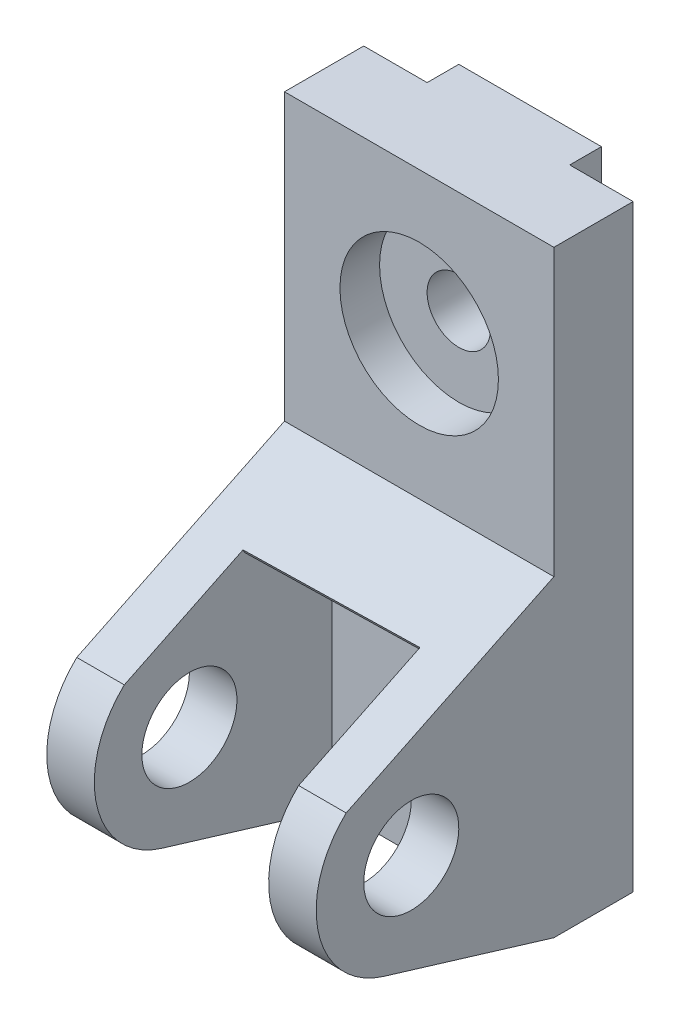
from build123d import *

# Parameters (mm, degrees)
SKETCH1_W            = 85
SKETCH1_H            = 90
SKETCH1_R            = 25
BOSS_EXTRUDE1_DEPTH  = 25
SKETCH1_3_R          = 25
BOSS_EXTRUDE2_DEPTH  = 25
SKETCH1_5_R          = 10
CUT_EXTRUDE1_DEPTH   = 72.960881466
SKETCH1_6_R          = 25
SKETCH1_6_R_2        = 10
CUT_EXTRUDE2_DEPTH   = 12.5
SKETCH3_R            = 15
BOSS_EXTRUDE3_DEPTH  = 15
SKETCH5_W            = 25
SKETCH5_H            = 98.657332742
CUT_EXTRUDE3_DEPTH   = 15
SKETCH8_W            = 85
SKETCH8_H            = 25
BOSS_EXTRUDE8_DEPTH  = 98
BOSS_EXTRUDE9_DEPTH  = 1
SKETCH12_W           = 45
SKETCH12_H           = 10
BOSS_EXTRUDE11_DEPTH = 188


with BuildPart() as part:
    # Sketch1 → Boss-Extrude1 (new body)
    with BuildSketch(Plane.XY):
        with Locations((-7.652354571, -0.145429363)):
            Rectangle(SKETCH1_W, SKETCH1_H)
        with Locations((-7.652354571, 0)):
            Circle(SKETCH1_R, mode=Mode.SUBTRACT)
    extrude(amount=-BOSS_EXTRUDE1_DEPTH)

    # Sketch3 → Boss-Extrude3 (add)
    with BuildSketch(Plane(origin=(34.847645429, 0, 0), x_dir=(0, 0, -1), z_dir=(1, 0, 0))):
        with BuildLine():
            Line((-53.708286934, -127.511049039), (0, -143.802762105))
            Line((0, -143.802762105), (25, -143.802762105))
            Line((25, -143.802762105), (25, -45.145429363))
            Line((25, -45.145429363), (0, -45.145429363))
            Line((0, -45.145429363), (-65.54026385, -76.937319943))
            ThreePointArc((-65.54026385, -76.937319943), (-74.211212735, -105.636871453), (-53.708286934, -127.511049039))
        make_face()
        with Locations((-45, -98.802762105)):
            Circle(SKETCH3_R, mode=Mode.SUBTRACT)
    extrude(amount=-BOSS_EXTRUDE3_DEPTH)


with BuildPart() as body_2:
    # Sketch1<3> → Boss-Extrude2 (new body)
    with BuildSketch(Plane.XY):
        with Locations((-7.652354571, 0)):
            Circle(SKETCH1_3_R)
    extrude(amount=-BOSS_EXTRUDE2_DEPTH)

    # Sketch1<5> → Cut-Extrude1 (cut, through all)
    with BuildSketch(Plane.XY):
        with Locations((-7.652354571, 0)):
            Circle(SKETCH1_5_R)
    extrude(amount=-CUT_EXTRUDE1_DEPTH, mode=Mode.SUBTRACT)

    # Sketch1<6> → Cut-Extrude2 (cut)
    with BuildSketch(Plane.XY):
        with Locations((-7.652354571, 0)):
            Circle(SKETCH1_6_R)
        with Locations((-7.652354571, 0)):
            Circle(SKETCH1_6_R_2, mode=Mode.SUBTRACT)
    extrude(amount=-CUT_EXTRUDE2_DEPTH, mode=Mode.SUBTRACT)


with BuildPart() as body_3:
    # Mirror1: mirrored copy
    add(part.part.mirror(Plane(origin=(-7.652354571, 0, 0), x_dir=(0, 0, 1), z_dir=(1, 0, 0))))

    # Sketch5 → Cut-Extrude3 (cut)
    with BuildSketch(Plane.ZY.offset(50.152354571)):
        with Locations((-12.5, -94.474095734)):
            Rectangle(SKETCH5_W, SKETCH5_H)
    extrude(amount=-CUT_EXTRUDE3_DEPTH, mode=Mode.SUBTRACT)


with BuildPart() as cut_extrude3_piece_1:
    # of the separate pieces the step leaves, piece 1, a body of its own (cut_extrude3_pieces)
    add(body_3.part.solids().sort_by_distance((34.847645429, 44.854570637, 0))[0])


with BuildPart() as cut_extrude3_piece_2:
    # of the separate pieces the step leaves, piece 2, a body of its own (cut_extrude3_pieces)
    add(body_3.part.solids().sort_by_distance((-50.152354571, -76.937319943, 65.54026385))[0])


with BuildPart() as part_1:
    add(part.part)

    add(cut_extrude3_piece_1.part)  # Boss-Extrude8 merges Cut-Extrude3 piece 1

    add(cut_extrude3_piece_2.part)  # Boss-Extrude8 merges Cut-Extrude3 piece 2
    # Sketch8 → Boss-Extrude8 (add)
    with BuildSketch(Plane.XZ.offset(45.145429363)):
        with Locations((-7.652354571, -12.5)):
            Rectangle(SKETCH8_W, SKETCH8_H)
    extrude(amount=BOSS_EXTRUDE8_DEPTH)

    # Sketch9 → Boss-Extrude9 (add)
    with BuildSketch(Plane(origin=(0, -36.5462155, -17.727625982), x_dir=(1, 0, 0), z_dir=(0, 0.8997343711779642, 0.4364379237887027))):
        Polygon((-50.152354571, -51.174548766), (34.847645429, -49.760817749), (34.847645429, -19.70317746), (-50.152354571, -19.70317746), align=None)
    extrude(amount=-BOSS_EXTRUDE9_DEPTH)

    add(body_2.part)  # Boss-Extrude11 merges body 2
    # Sketch12 → Boss-Extrude11 (add)
    with BuildSketch(Plane(origin=(0, 44.854570637, 0), x_dir=(1, 0, 0), z_dir=(0, 1, 0))):
        with Locations((-7.652354571, 30)):
            Rectangle(SKETCH12_W, SKETCH12_H)
    extrude(amount=-BOSS_EXTRUDE11_DEPTH)


solid = part_1.part
